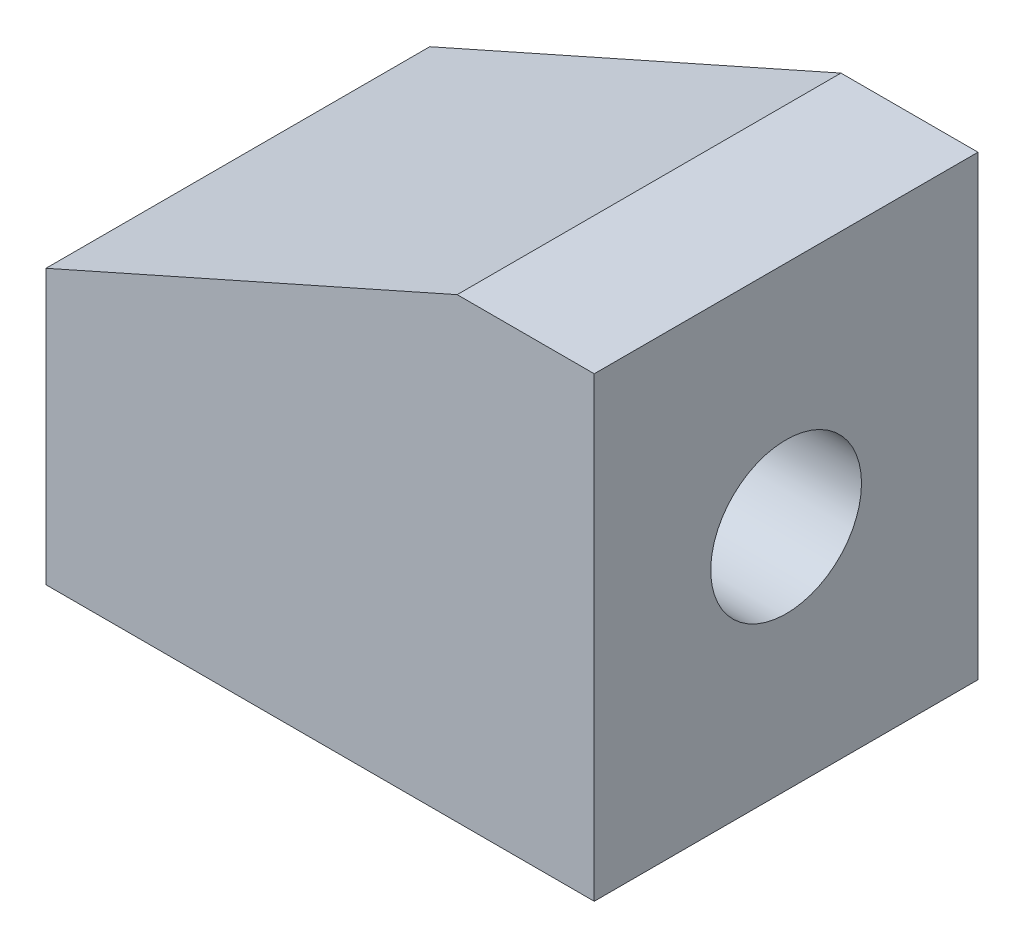
from build123d import *

# Parameters (mm, degrees)
ESTRUSIONE_ESTRUSIONE1_DEPTH   = 21
FORO_FILETTATO_M18X1_5_1_D     = 16.5
FORO_FILETTATO_M18X1_5_1_DEPTH = 38.542899893
FORO_FILETTATO_M18X1_5_1_TIP   = 4.957100107


with BuildPart() as part:
    # Schizzo1 → Estrusione-Estrusione1 (new, symmetric)
    with BuildSketch(Plane.XY):
        Polygon((30, 0), (30, 50), (15, 50), (-30, 30), (-30, 0), align=None)
    extrude(amount=ESTRUSIONE_ESTRUSIONE1_DEPTH, both=True)

    # Foro filettato M18x1.5-1
    with Locations(Plane(origin=(30, 0, 0), x_dir=(0, 0, -1), z_dir=(1, 0, 0))):
        with Locations((0, 25)):
            Hole(FORO_FILETTATO_M18X1_5_1_D / 2, depth=FORO_FILETTATO_M18X1_5_1_DEPTH)
            with Locations((0, 0, -(FORO_FILETTATO_M18X1_5_1_DEPTH + FORO_FILETTATO_M18X1_5_1_TIP / 2))):  # 118° drill point
                Cone(0, FORO_FILETTATO_M18X1_5_1_D / 2, FORO_FILETTATO_M18X1_5_1_TIP, mode=Mode.SUBTRACT)


solid = part.part
